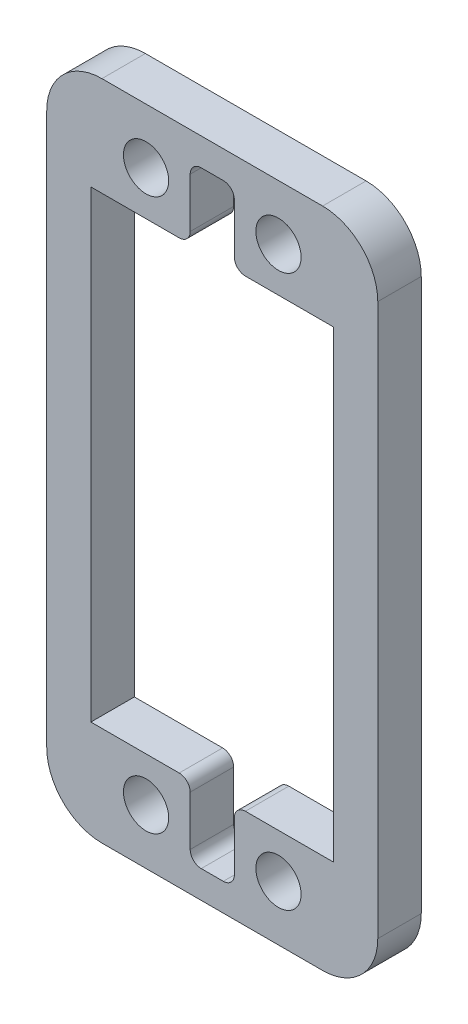
from build123d import *

# Parameters (mm, degrees)
CROQUIS1_W              = 30
CROQUIS1_H              = 60
SALIENTE_EXTRUIR1_DEPTH = 3.94
CROQUIS2_W              = 22
CROQUIS2_H              = 42
CORTAR_EXTRUIR1_DEPTH   = 34.771638989
CROQUIS3_R              = 2.05
CORTAR_EXTRUIR2_DEPTH   = 34.771638989
REDONDEO1_R             = 5
REDONDEO3_R             = 1


with BuildPart() as part:
    # Croquis1 → Saliente-Extruir1 (new body)
    with BuildSketch(Plane.XY):
        Rectangle(CROQUIS1_W, CROQUIS1_H)
    extrude(amount=SALIENTE_EXTRUIR1_DEPTH)

    # Croquis2 → Cortar-Extruir1 (cut, through all)
    with BuildSketch(Plane(origin=(0, 0, 0), x_dir=(-1, 0, 0), z_dir=(0, 0, -1))):
        Rectangle(CROQUIS2_W, CROQUIS2_H)
    extrude(amount=-CORTAR_EXTRUIR1_DEPTH, mode=Mode.SUBTRACT)

    # Croquis3 → Cortar-Extruir2 (cut, through all)
    with BuildSketch(Plane(origin=(0, 0, 0), x_dir=(-1, 0, 0), z_dir=(0, 0, -1))):
        with Locations((-6, 25)):
            Circle(CROQUIS3_R)
        with Locations((6, 25)):
            Circle(CROQUIS3_R)
        with Locations((-6, -25)):
            Circle(CROQUIS3_R)
        with Locations((6, -25)):
            Circle(CROQUIS3_R)
        Polygon((-2, 21), (-2, 27.5), (2, 27.5), (2, -27.5), (-2, -27.5), align=None)
    extrude(amount=-CORTAR_EXTRUIR2_DEPTH, mode=Mode.SUBTRACT)

    # Redondeo1
    redondeo1_edges = [part.edges().sort_by_distance(p)[0] for p in [
        (-15, 30, 1.97),
        (15, 30, 1.97),
        (15, -30, 1.97),
        (-15, -30, 1.97),
    ]]
    fillet(redondeo1_edges, radius=REDONDEO1_R)

    # Redondeo3
    redondeo3_edges = [part.edges().sort_by_distance(p)[0] for p in [
        (2, -21, 1.97),
        (-2, -21, 1.97),
        (-2, 21, 1.97),
        (-2, 27.5, 1.97),
        (2, 21, 1.97),
        (2, -27.5, 1.97),
        (-2, -27.5, 1.97),
        (2, 27.5, 1.97),
    ]]
    fillet(redondeo3_edges, radius=REDONDEO3_R)


solid = part.part
